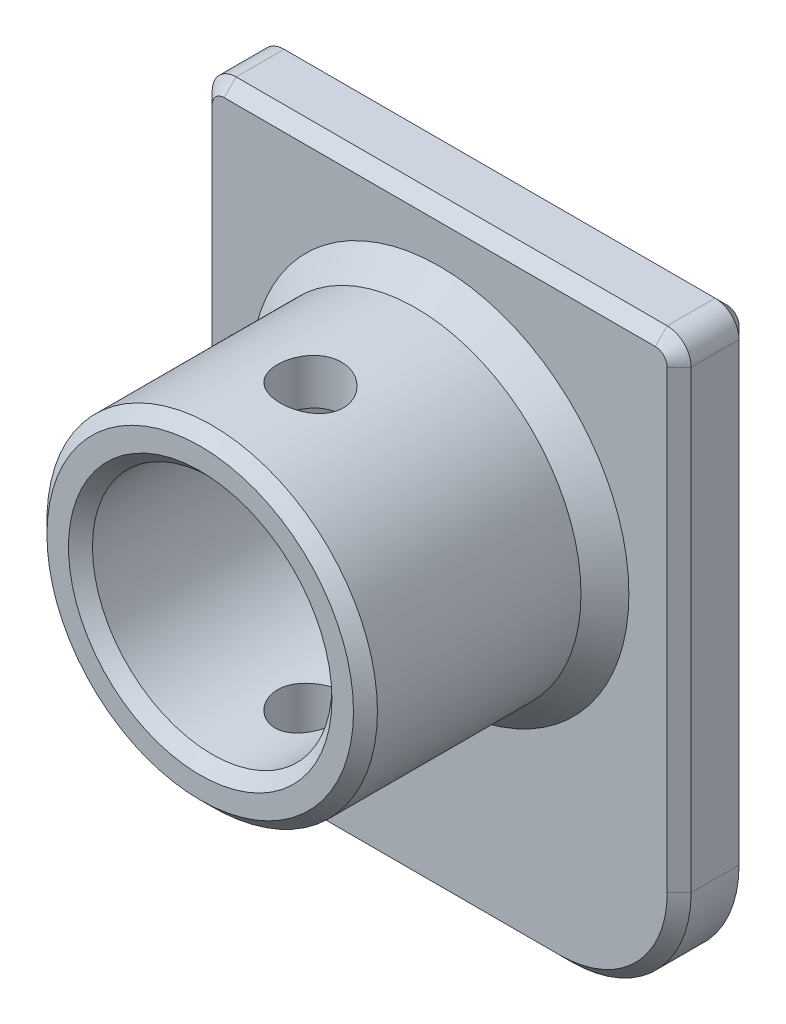
from build123d import *

# Parameters (mm, degrees)
SKETCH2_R           = 6.9
BOSS_EXTRUDE1_DEPTH = 3
SKETCH3_R           = 6.9
SKETCH3_R_2         = 5
BOSS_EXTRUDE2_DEPTH = 13
CHAMFER1_SIZE       = 0.5
CHAMFER2_SIZE       = 1
SKETCH4_R           = 1.375
CUT_EXTRUDE1_DEPTH  = 20


with BuildPart() as part:
    # Sketch2 → Boss-Extrude1 (new body)
    with BuildSketch(Plane.XY):
        with BuildLine():
            Line((102.765440341, 138.860814374), (120.765440341, 138.860814374))
            ThreePointArc((120.765440341, 138.860814374), (121.472547122, 138.567921155), (121.765440341, 137.860814374))
            Line((121.765440341, 137.860814374), (121.765440341, 118.860814374))
            ThreePointArc((121.765440341, 118.860814374), (120.300974247, 115.325280468), (116.765440341, 113.860814374))
            Line((116.765440341, 113.860814374), (106.765440341, 113.860814374))
            ThreePointArc((106.765440341, 113.860814374), (103.229906435, 115.325280468), (101.765440341, 118.860814374))
            Line((101.765440341, 118.860814374), (101.765440341, 137.860814374))
            ThreePointArc((101.765440341, 137.860814374), (102.058333559, 138.567921155), (102.765440341, 138.860814374))
        make_face()
        with Locations((111.765440341, 128.860814374)):
            Circle(SKETCH2_R, mode=Mode.SUBTRACT)
    extrude(amount=BOSS_EXTRUDE1_DEPTH)

    # Sketch3 → Boss-Extrude2 (add)
    with BuildSketch(Plane.XY):
        with Locations(Location((111.765440341, 128.860814374, 0), (0, 0, 180))):
            Circle(SKETCH3_R)
        with Locations(Location((111.765440341, 128.860814374, 0), (0, 0, 180))):
            Circle(SKETCH3_R_2, mode=Mode.SUBTRACT)
    extrude(amount=BOSS_EXTRUDE2_DEPTH)

    # Chamfer1
    chamfer1_edges = [part.edges().sort_by_distance(p)[0] for p in [
        (121.472547122, 138.567921155, 0),
        (121.765440341, 128.360814374, 0),
        (111.765440341, 138.860814374, 3),
        (120.300974247, 115.325280468, 0),
        (111.765440341, 113.860814374, 0),
        (103.229906435, 115.325280468, 0),
        (101.765440341, 128.360814374, 0),
        (102.058333559, 138.567921155, 0),
        (111.765440341, 138.860814374, 0),
        (102.058333559, 138.567921155, 3),
        (101.765440341, 128.360814374, 3),
        (103.229906435, 115.325280468, 3),
        (118.665440341, 128.860814374, 13),
        (116.765440341, 128.860814374, 0),
        (116.765440341, 128.860814374, 13),
        (111.765440341, 113.860814374, 3),
        (120.300974247, 115.325280468, 3),
        (121.765440341, 128.360814374, 3),
        (121.472547122, 138.567921155, 3),
    ]]
    chamfer(chamfer1_edges, length=CHAMFER1_SIZE)

    # Chamfer2
    chamfer2_edges = [part.edges().sort_by_distance(p)[0] for p in [
        (118.665440341, 128.860814374, 3),
    ]]
    chamfer(chamfer2_edges, length=CHAMFER2_SIZE)

    # Sketch4 → Cut-Extrude1 (cut)
    with BuildSketch(Plane(origin=(0, 138.860814374, 0), x_dir=(1, 0, 0), z_dir=(0, 1, 0))):
        with Locations(Location((112.244247242, -8.875, 0), (0, 0, 270))):
            Circle(SKETCH4_R)
    extrude(amount=-CUT_EXTRUDE1_DEPTH, mode=Mode.SUBTRACT)


solid = part.part
